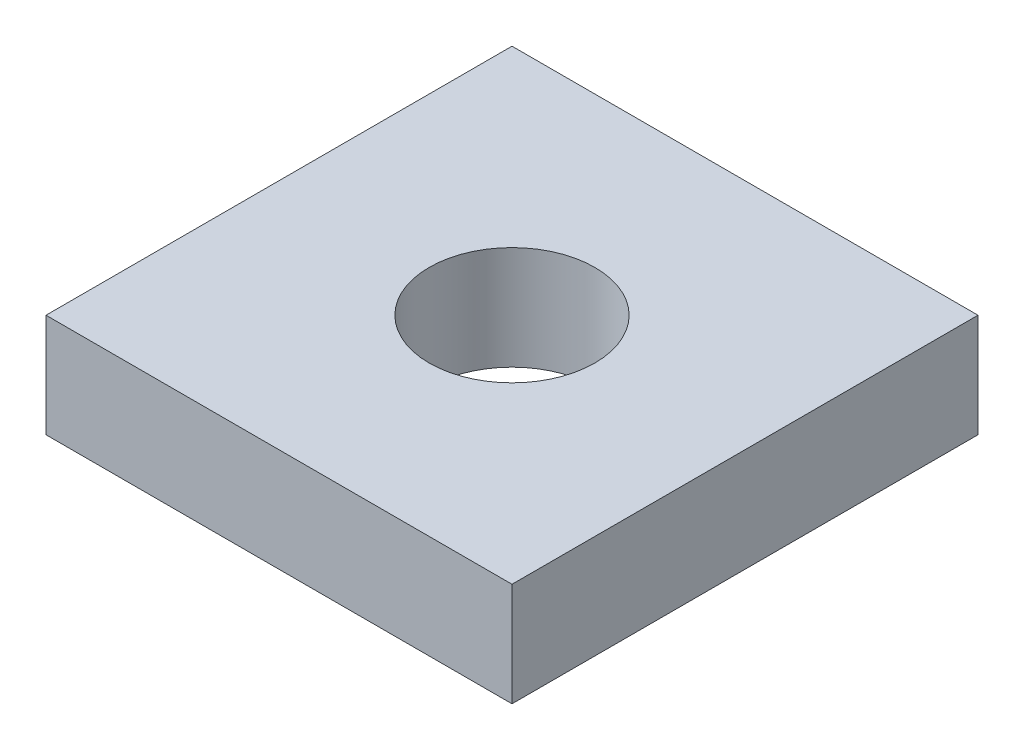
from build123d import *

# Parameters (mm, degrees)
SKETCH1_W           = 45
SKETCH1_H           = 45
SKETCH1_R           = 8
BOSS_EXTRUDE1_DEPTH = 10


with BuildPart() as part:
    # Sketch1 → Boss-Extrude1 (new body)
    with BuildSketch(Plane(origin=(0, 0, 0), x_dir=(1, 0, 0), z_dir=(0, 1, 0))):
        with Locations((22.5, 22.5)):
            Rectangle(SKETCH1_W, SKETCH1_H)
        with Locations(Location((22.5, 22.5, 0), (0, 0, 270))):
            Circle(SKETCH1_R, mode=Mode.SUBTRACT)
    extrude(amount=BOSS_EXTRUDE1_DEPTH)


solid = part.part
